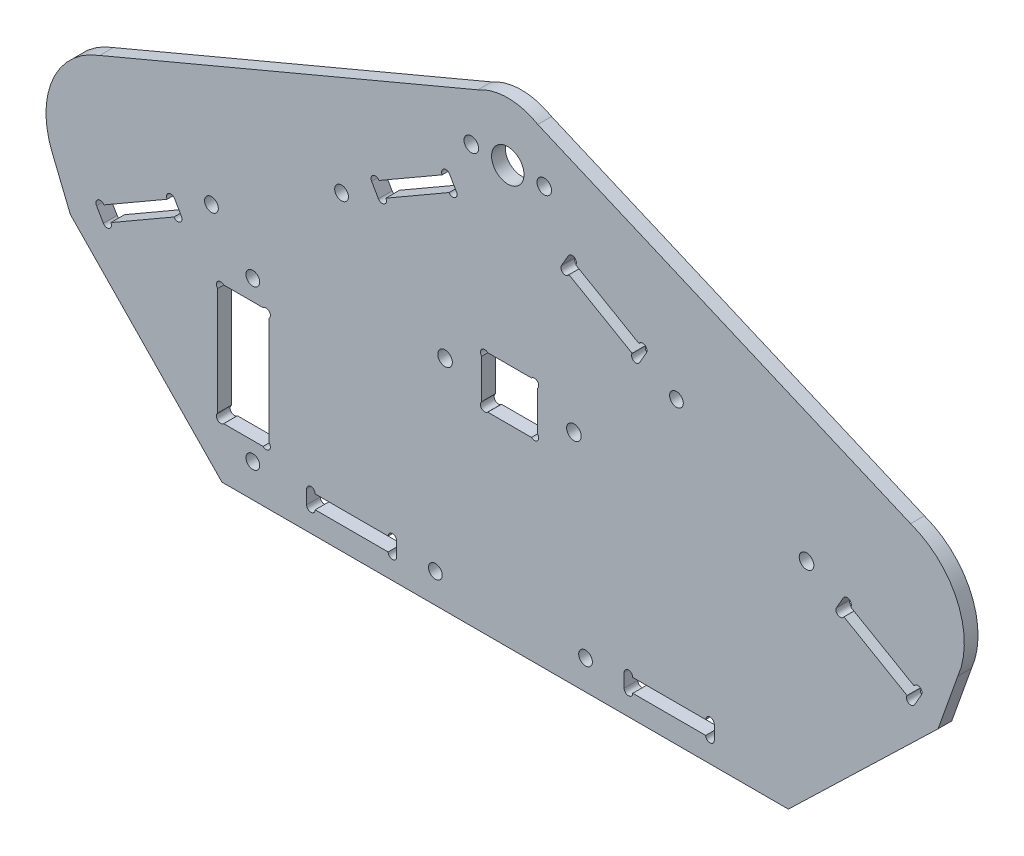
from build123d import *

# Parameters (mm, degrees)
MODEL_R             = 3.781579339
MODEL_R_2           = 1.7
MODEL_R_3           = 1.6
MODEL_W             = 12
MODEL_H             = 28
MODEL_W_2           = 13
MODEL_H_2           = 12
BOSS_EXTRUDE2_DEPTH = 3.2
SKETCH1_R           = 1.0005
CUT_EXTRUDE1_DEPTH  = 312.966216485


with BuildPart() as part:
    # Model → Boss-Extrude2 (new body)
    with BuildSketch(Plane.XY):
        with BuildLine():
            Line((88, 60), (220, 60))
            Line((220, 60), (254.882583618, 93.640518188))
            Line((254.882583618, 93.640518188), (259.489592216, 106.576108559))
            ThreePointArc((259.489592216, 106.576108559), (259.424141413, 121.57623231), (248.498382723, 131.854159795))
            Line((248.498382723, 131.854159795), (161.617078665, 168.980084934))
            ThreePointArc((161.617078665, 168.980084934), (154.617078665, 170.855729281), (147.617078665, 168.980084934))
            Line((147.617078665, 168.980084934), (59.501617277, 131.854159795))
            ThreePointArc((59.501617277, 131.854159795), (48.575858587, 121.57623231), (48.510407784, 106.576108559))
            Line((48.510407784, 106.576108559), (52.677086204, 96.362955936))
            Line((52.677086204, 96.362955936), (88, 60))
        make_face()
        with Locations((154.617078665, 157.237991333)):
            Circle(MODEL_R, mode=Mode.SUBTRACT)
        with Locations((163.114624023, 157.237991333)):
            Circle(MODEL_R_2, mode=Mode.SUBTRACT)
        with Locations((146.117078665, 157.237991333)):
            Circle(MODEL_R_2, mode=Mode.SUBTRACT)
        with Locations((115.877120948, 132.296819167)):
            Circle(MODEL_R_3, mode=Mode.SUBTRACT)
        with Locations((137.734977924, 66.871509225)):
            Circle(MODEL_R_3, mode=Mode.SUBTRACT)
        with Locations((193.918561918, 129.673741782)):
            Circle(MODEL_R_3, mode=Mode.SUBTRACT)
        with Locations((172.735008, 66.871509225)):
            Circle(MODEL_R_3, mode=Mode.SUBTRACT)
        with Locations((170.033762, 111.08294)):
            Circle(MODEL_R_2, mode=Mode.SUBTRACT)
        with Locations((140, 111)):
            Circle(MODEL_R_2, mode=Mode.SUBTRACT)
        with Locations((95.2, 104.75)):
            Circle(MODEL_R_3, mode=Mode.SUBTRACT)
        with Locations((85.560630532, 114.806524888)):
            Circle(MODEL_R_3, mode=Mode.SUBTRACT)
        with Locations((224.233700932, 112.158328537)):
            Circle(MODEL_R_2, mode=Mode.SUBTRACT)
        with Locations((95.2, 67.75)):
            Circle(MODEL_R_3, mode=Mode.SUBTRACT)
        with Locations((93, 86)):
            Rectangle(MODEL_W, MODEL_H, mode=Mode.SUBTRACT)
        Polygon((181.734462562, 65.257395619), (181.735489, 68.457395619), (202.735488, 68.450659619), (202.734461562, 65.250659619), align=None, mode=Mode.SUBTRACT)
        Polygon((249.399348556, 95.770313962), (231.216181373, 106.276143646), (232.817069658, 109.046911896), (251.000236841, 98.541082213), align=None, mode=Mode.SUBTRACT)
        Polygon((60.374623433, 98.42894725), (58.775510803, 101.200740676), (76.965405371, 111.694917426), (78.564518, 108.923124), align=None, mode=Mode.SUBTRACT)
        Polygon((128.734464562, 65.274396), (128.735491, 68.474396), (107.735493, 68.481132), (107.734466562, 65.281132), align=None, mode=Mode.SUBTRACT)
        Polygon((142.66224045, 145.902603249), (124.4723462, 135.408426681), (122.873233571, 138.180220108), (136.035908619, 145.774076024), (141.063127638, 148.674396991), align=None, mode=Mode.SUBTRACT)
        Polygon((167.142166, 143.296685), (168.743054285, 146.067453251), (186.926220285, 135.561624251), (185.325332, 132.790856), align=None, mode=Mode.SUBTRACT)
        with Locations((155.035687, 111.089836)):
            Rectangle(MODEL_W_2, MODEL_H_2, mode=Mode.SUBTRACT)
    extrude(amount=BOSS_EXTRUDE2_DEPTH)

    # Sketch1 → Cut-Extrude1 (cut, through all)
    with BuildSketch(Plane.XY.offset(3.2)):
        with Locations((61.241241971, 98.928919808)):
            Circle(SKETCH1_R)
        with Locations((59.642129342, 101.700713234)):
            Circle(SKETCH1_R)
        with Locations((76.098786832, 111.194944868)):
            Circle(SKETCH1_R)
        with Locations((77.697899462, 108.423151442)):
            Circle(SKETCH1_R)
        with Locations((87.707460335, 99.292539665)):
            Circle(SKETCH1_R)
        with Locations((98.292539665, 99.292539665)):
            Circle(SKETCH1_R)
        with Locations((87.707460335, 72.707460335)):
            Circle(SKETCH1_R)
        with Locations((98.292539665, 72.707460335)):
            Circle(SKETCH1_R)
        with Locations((108.735992948, 68.480811078)):
            Circle(SKETCH1_R)
        with Locations((108.73496651, 65.280811078)):
            Circle(SKETCH1_R)
        with Locations((127.733964613, 65.274716923)):
            Circle(SKETCH1_R)
        with Locations((127.734991051, 68.474716923)):
            Circle(SKETCH1_R)
        with Locations((182.73496251, 65.257074697)):
            Circle(SKETCH1_R)
        with Locations((182.735988949, 68.457074697)):
            Circle(SKETCH1_R)
        with Locations((201.734988051, 68.450980541)):
            Circle(SKETCH1_R)
        with Locations((201.733961613, 65.250980541)):
            Circle(SKETCH1_R)
        with Locations((232.082479384, 105.775615918)):
            Circle(SKETCH1_R)
        with Locations((233.683367669, 108.546384168)):
            Circle(SKETCH1_R)
        with Locations((250.13393883, 99.041609941)):
            Circle(SKETCH1_R)
        with Locations((248.533050545, 96.27084169)):
            Circle(SKETCH1_R)
        with Locations((160.828226665, 105.797296335)):
            Circle(SKETCH1_R)
        with Locations((160.828226665, 116.382375665)):
            Circle(SKETCH1_R)
        with Locations((149.243147335, 105.797296335)):
            Circle(SKETCH1_R)
        with Locations((149.243147335, 116.382375665)):
            Circle(SKETCH1_R)
        with Locations((168.008464011, 142.796157272)):
            Circle(SKETCH1_R)
        with Locations((169.609352296, 145.566925523)):
            Circle(SKETCH1_R)
        with Locations((184.459033989, 133.291383728)):
            Circle(SKETCH1_R)
        with Locations((186.059922274, 136.062151978)):
            Circle(SKETCH1_R)
        with Locations((141.795621912, 145.402630691)):
            Circle(SKETCH1_R)
        with Locations((140.196509099, 148.174424012)):
            Circle(SKETCH1_R)
        with Locations((123.739852109, 138.680192666)):
            Circle(SKETCH1_R)
        with Locations((125.338964739, 135.90839924)):
            Circle(SKETCH1_R)
    extrude(amount=-CUT_EXTRUDE1_DEPTH, mode=Mode.SUBTRACT)


solid = part.part
